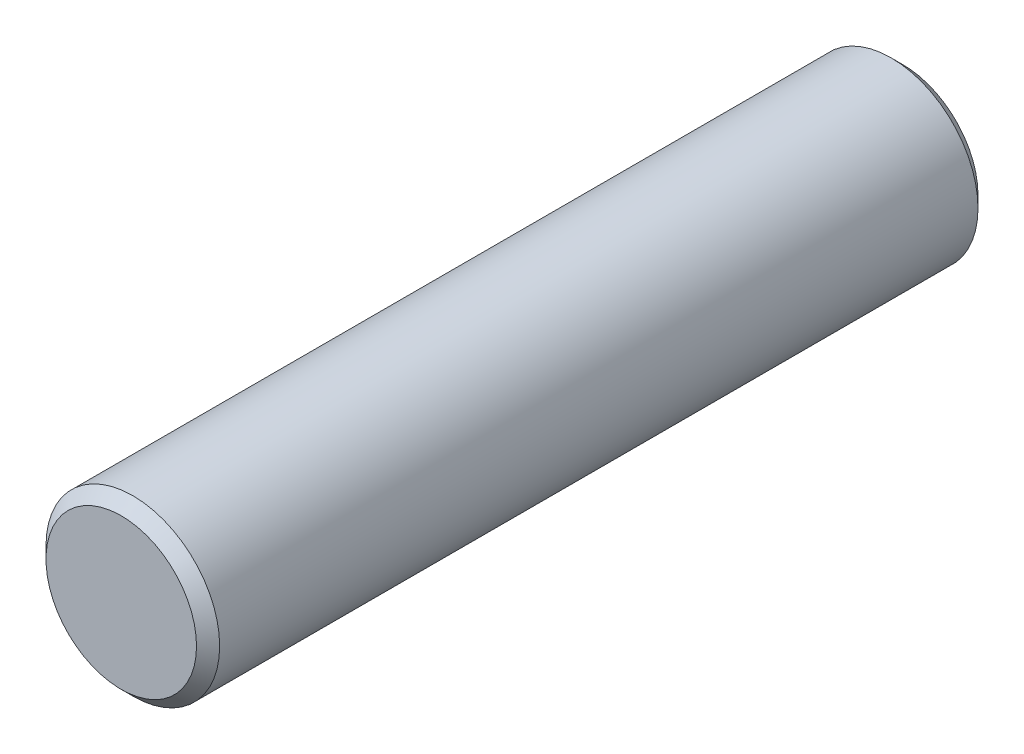
from build123d import *

# Parameters (mm, degrees)
SKETCH1_R           = 1.5
BOSS_EXTRUDE1_DEPTH = 6.75
CHAMFER1_SIZE       = 0.2
SCALE1_SCALE        = 1.5


with BuildPart() as part:
    # Sketch1 → Boss-Extrude1 (new, symmetric)
    with BuildSketch(Plane.XY):
        Circle(SKETCH1_R)
    extrude(amount=BOSS_EXTRUDE1_DEPTH, both=True)

    # Chamfer1
    chamfer1_edges = [part.edges().sort_by_distance(p)[0] for p in [
        (-1.5, 0, -6.75),
        (-1.5, 0, 6.75),
    ]]
    chamfer(chamfer1_edges, length=CHAMFER1_SIZE)


with BuildPart() as part_1:
    # Scale1: scaled about (0, 0, 0)
    add(part.part.scale(SCALE1_SCALE))


solid = part_1.part
